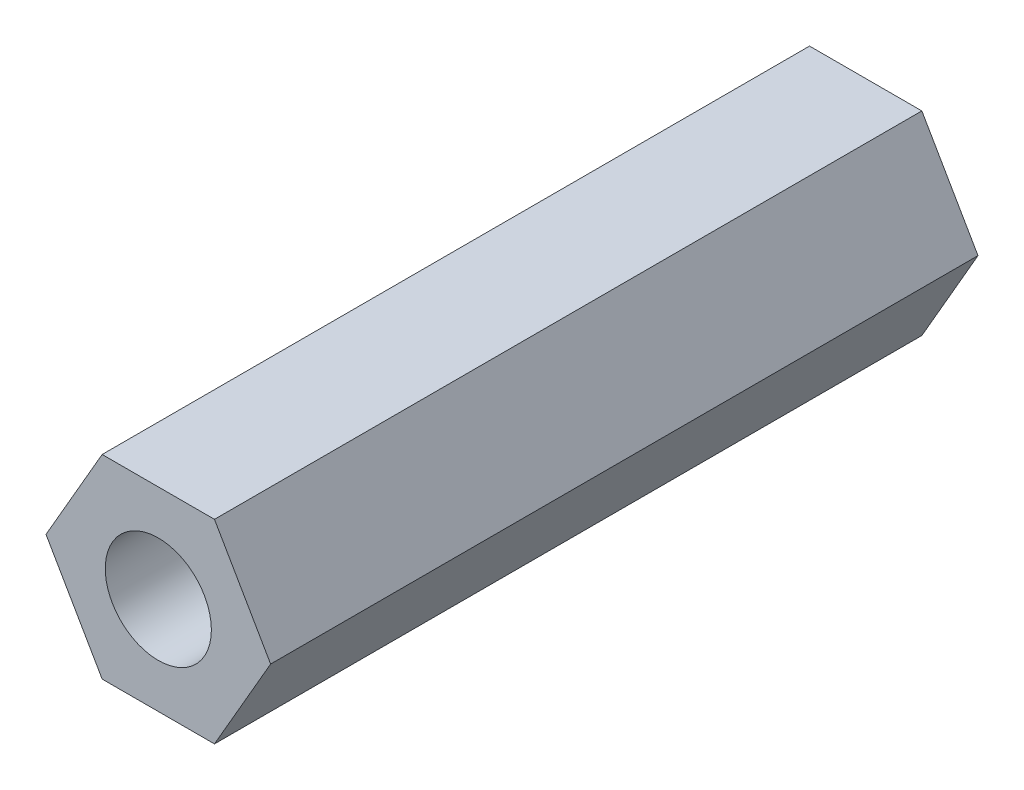
from build123d import *

# Parameters (mm, degrees)
SKETCH1_R           = 1.5
BOSS_EXTRUDE1_DEPTH = 20


with BuildPart() as part:
    # Sketch1 → Boss-Extrude1 (new body)
    with BuildSketch(Plane.XY):
        Polygon((3.175426481, 0), (1.58771324, 2.75), (-1.58771324, 2.75), (-3.175426481, 0), (-1.58771324, -2.75), (1.58771324, -2.75), align=None)
        Circle(SKETCH1_R, mode=Mode.SUBTRACT)
    extrude(amount=BOSS_EXTRUDE1_DEPTH)


solid = part.part
